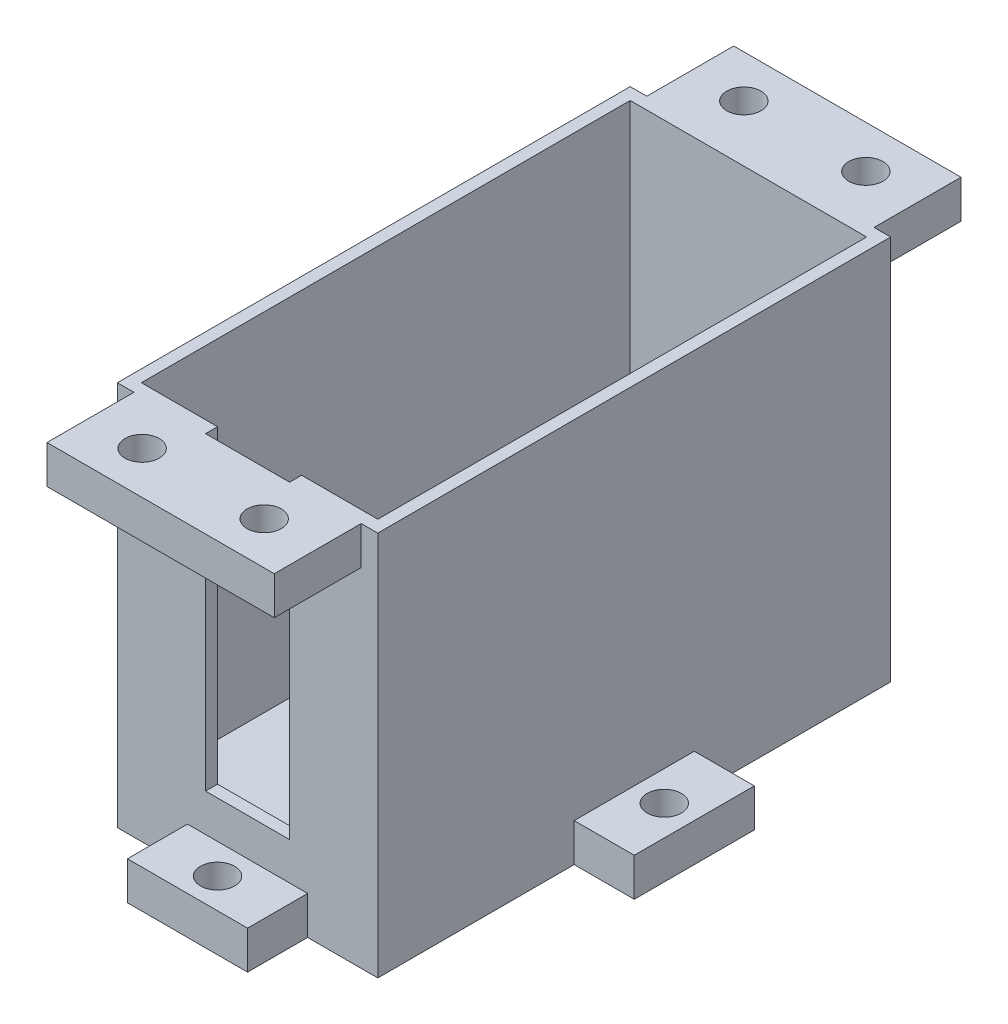
from build123d import *

# Parameters (mm, degrees)
SKETCH1_R           = 1.425
BOSS_EXTRUDE1_DEPTH = 3.175
SKETCH2_W           = 21.685
SKETCH2_H           = 42.7
SKETCH2_W_2         = 19.685
SKETCH2_H_2         = 40.7
BOSS_EXTRUDE2_DEPTH = 28.905
SKETCH3_W           = 18.923
SKETCH3_H           = 7.239
SKETCH3_R           = 1.425
BOSS_EXTRUDE3_DEPTH = 3.175
SKETCH4_W           = 7
SKETCH4_H           = 25.77275476
CUT_EXTRUDE1_DEPTH  = 3.175


with BuildPart() as part:
    # Sketch1 → Boss-Extrude1 (new body)
    with BuildSketch(Plane(origin=(0, 0, 0), x_dir=(1, 0, 0), z_dir=(0, 1, 0))):
        Polygon((10.8425, -21.35), (5, -21.35), (5, -26.35), (-5, -26.35), (-5, -21.35), (-10.8425, -21.35), (-10.8425, -5), (-15.8425, -5), (-15.8425, 5), (-10.8425, 5), (-10.8425, 21.35), (-5, 21.35), (-5, 26.35), (5, 26.35), (5, 21.35), (10.8425, 21.35), (10.8425, 5), (15.8425, 5), (15.8425, -5), (10.8425, -5), align=None)
        with Locations(Location((0, 23.85, 0), (0, 0, 270))):
            Circle(SKETCH1_R, mode=Mode.SUBTRACT)
        with Locations(Location((-13.3425, 0, 0), (0, 0, 270))):
            Circle(SKETCH1_R, mode=Mode.SUBTRACT)
        with Locations(Location((13.3425, 0, 0), (0, 0, 270))):
            Circle(SKETCH1_R, mode=Mode.SUBTRACT)
        with Locations(Location((0, -23.85, 0), (0, 0, 270))):
            Circle(SKETCH1_R, mode=Mode.SUBTRACT)
    extrude(amount=BOSS_EXTRUDE1_DEPTH)

    # Sketch2 → Boss-Extrude2 (add)
    with BuildSketch(Plane(origin=(0, 3.175, 0), x_dir=(1, 0, 0), z_dir=(0, 1, 0))):
        Rectangle(SKETCH2_W, SKETCH2_H)
        Rectangle(SKETCH2_W_2, SKETCH2_H_2, mode=Mode.SUBTRACT)
    extrude(amount=BOSS_EXTRUDE2_DEPTH)

    # Sketch3 → Boss-Extrude3 (add)
    # profile 1 of 2: a face of its own
    with BuildSketch(Plane(origin=(0, 32.08, 0), x_dir=(1, 0, 0), z_dir=(0, 1, 0))):
        with Locations((0, 24.9695)):
            Rectangle(SKETCH3_W, SKETCH3_H)
        with Locations(Location((-5.08, 25.049, 0), (0, 0, 270))):
            Circle(SKETCH3_R, mode=Mode.SUBTRACT)
        with Locations(Location((5.08, 25.049, 0), (0, 0, 270))):
            Circle(SKETCH3_R, mode=Mode.SUBTRACT)
    # profile 2 of 2: a face of its own
    with BuildSketch(Plane(origin=(0, 32.08, 0), x_dir=(1, 0, 0), z_dir=(0, 1, 0))):
        with Locations((0, -24.9695)):
            Rectangle(SKETCH3_W, SKETCH3_H)
        with Locations(Location((-5.08, -25.049, 0), (0, 0, 270))):
            Circle(SKETCH3_R, mode=Mode.SUBTRACT)
        with Locations(Location((5.08, -25.049, 0), (0, 0, 270))):
            Circle(SKETCH3_R, mode=Mode.SUBTRACT)
    extrude(amount=-BOSS_EXTRUDE3_DEPTH)

    # Sketch4 → Cut-Extrude1 (cut)
    with BuildSketch(Plane.XY.offset(21.35)):
        with Locations((0, 19.19362262)):
            Rectangle(SKETCH4_W, SKETCH4_H)
    extrude(amount=-CUT_EXTRUDE1_DEPTH, mode=Mode.SUBTRACT)


solid = part.part
